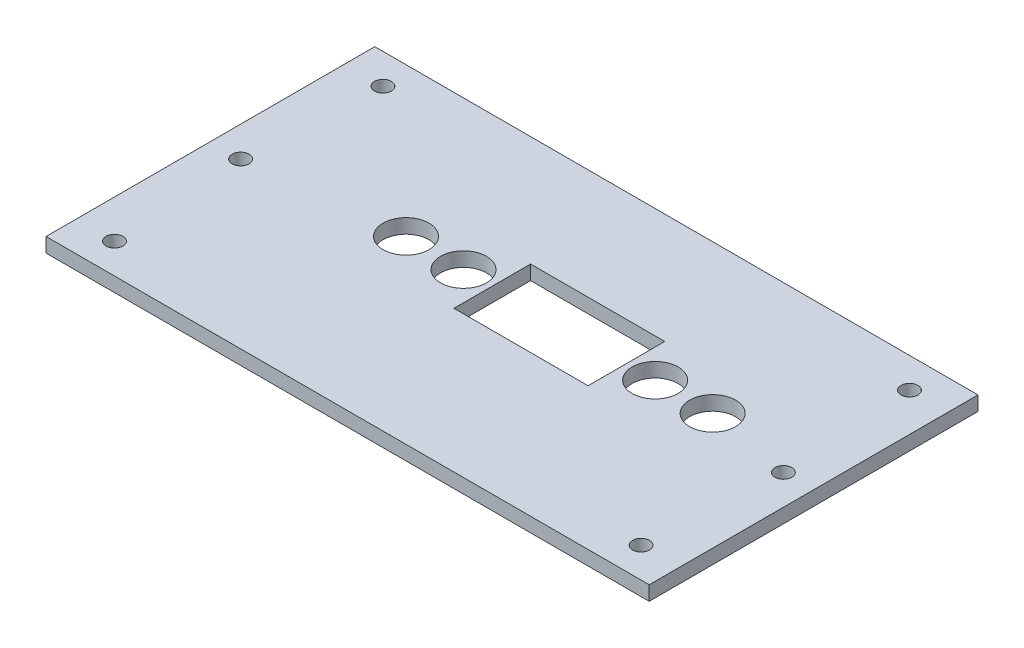
from build123d import *

# Parameters (mm, degrees)
SKETCH1_W           = 199.898
SKETCH1_H           = 108.966
SKETCH1_R           = 7.62
SKETCH1_R_2         = 2.794
SKETCH1_W_2         = 44.45
SKETCH1_H_2         = 25.4
BOSS_EXTRUDE1_DEPTH = 4.7625


with BuildPart() as part:
    # Sketch1 → Boss-Extrude1 (new body)
    with BuildSketch(Plane(origin=(0, 0, 0), x_dir=(1, 0, 0), z_dir=(0, 1, 0))):
        with Locations((-10.4775, -5.207)):
            Rectangle(SKETCH1_W, SKETCH1_H)
        with Locations(Location((-50.8, 0, 0), (0, 0, 90))):
            Circle(SKETCH1_R, mode=Mode.SUBTRACT)
        with Locations(Location((-31.75, 0, 0), (0, 0, 90))):
            Circle(SKETCH1_R, mode=Mode.SUBTRACT)
        with Locations(Location((31.75, 0, 0), (0, 0, 90))):
            Circle(SKETCH1_R, mode=Mode.SUBTRACT)
        with Locations(Location((50.8, 0, 0), (0, 0, 90))):
            Circle(SKETCH1_R, mode=Mode.SUBTRACT)
        with Locations(Location((-97.7265, 39.2684, 0), (0, 0, 90))):
            Circle(SKETCH1_R_2, mode=Mode.SUBTRACT)
        with Locations(Location((76.7715, 39.2684, 0), (0, 0, 90))):
            Circle(SKETCH1_R_2, mode=Mode.SUBTRACT)
        with Locations(Location((79.4639, -5.207, 0), (0, 0, 90))):
            Circle(SKETCH1_R_2, mode=Mode.SUBTRACT)
        with Locations(Location((76.7715, -49.6824, 0), (0, 0, 90))):
            Circle(SKETCH1_R_2, mode=Mode.SUBTRACT)
        with Locations(Location((-97.7265, -49.6824, 0), (0, 0, 90))):
            Circle(SKETCH1_R_2, mode=Mode.SUBTRACT)
        with Locations(Location((-100.4189, -5.207, 0), (0, 0, 90))):
            Circle(SKETCH1_R_2, mode=Mode.SUBTRACT)
        Rectangle(SKETCH1_W_2, SKETCH1_H_2, mode=Mode.SUBTRACT)
    extrude(amount=BOSS_EXTRUDE1_DEPTH)


solid = part.part
